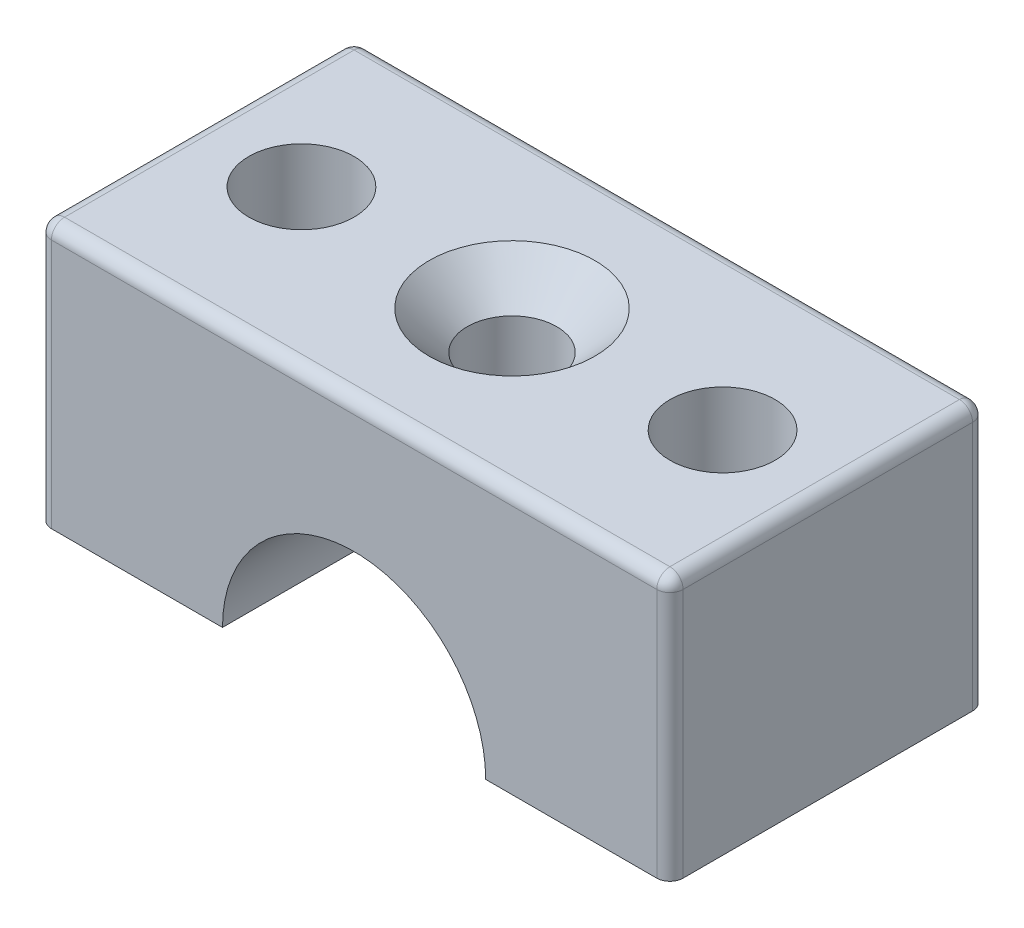
from build123d import *

# Parameters (mm, degrees)
BOSS_EXTRUDE1_DEPTH                             = 12
SKETCH2_R                                       = 2
CUT_EXTRUDE1_DEPTH                              = 29.635642127
CSK_FOR_M3_FLAT_HEAD_MACHINE_SCREW1_D           = 3.4
CSK_FOR_M3_FLAT_HEAD_MACHINE_SCREW1_CSINK_D     = 6.3
CSK_FOR_M3_FLAT_HEAD_MACHINE_SCREW1_CSINK_ANGLE = 90
FILLET1_R                                       = 0.5


with BuildPart() as part:
    # Sketch1 → Boss-Extrude1 (new body)
    with BuildSketch(Plane.XY):
        with BuildLine():
            Line((17, 0), (24, 0))
            Line((24, 0), (24, 10))
            Line((24, 10), (0, 10))
            Line((0, 10), (0, 0))
            Line((0, 0), (7, 0))
            ThreePointArc((7, 0), (12, 5), (17, 0))
        make_face()
    extrude(amount=BOSS_EXTRUDE1_DEPTH)

    # Sketch2 → Cut-Extrude1 (cut, through all)
    with BuildSketch(Plane(origin=(0, 10, 0), x_dir=(1, 0, 0), z_dir=(0, 1, 0))):
        with Locations(Location((4, -6, 0), (0, 0, 270))):
            Circle(SKETCH2_R)
        with Locations(Location((20, -6, 0), (0, 0, 270))):
            Circle(SKETCH2_R)
    extrude(amount=-CUT_EXTRUDE1_DEPTH, mode=Mode.SUBTRACT)

    # CSK for M3 Flat Head Machine Screw1 (through all)
    with Locations(Plane(origin=(0, 10, 0), x_dir=(1, 0, 0), z_dir=(0, 1, 0))):
        with Locations((12, -6)):
            CounterSinkHole(CSK_FOR_M3_FLAT_HEAD_MACHINE_SCREW1_D / 2, CSK_FOR_M3_FLAT_HEAD_MACHINE_SCREW1_CSINK_D / 2, counter_sink_angle=CSK_FOR_M3_FLAT_HEAD_MACHINE_SCREW1_CSINK_ANGLE)

    # Fillet1
    fillet1_edges = [part.edges().sort_by_distance(p)[0] for p in [
        (0, 10, 6),
        (24, 10, 6),
        (24, 5, 12),
        (12, 10, 12),
        (0, 5, 12),
        (12, 10, 0),
        (24, 5, 0),
        (0, 5, 0),
    ]]
    fillet(fillet1_edges, radius=FILLET1_R)


solid = part.part
